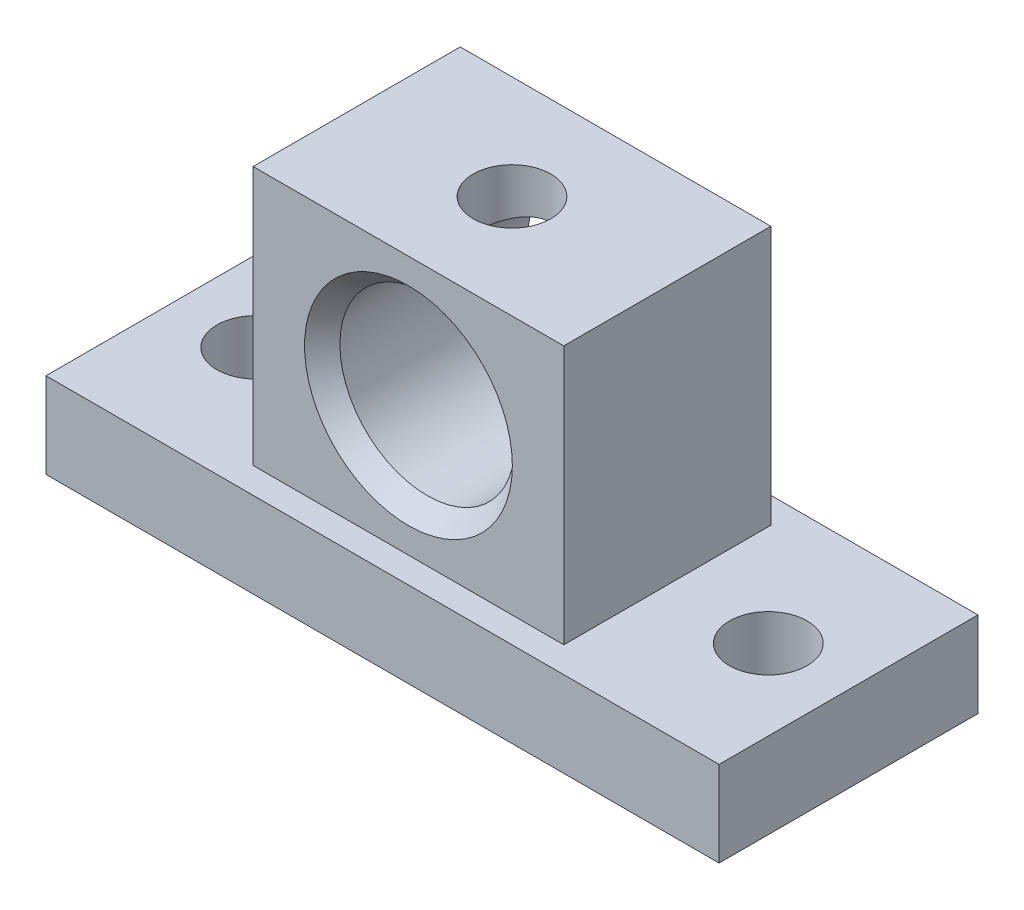
from build123d import *

# Parameters (mm, degrees)
SKETCH1_W                               = 26
SKETCH1_H                               = 10
SKETCH1_R                               = 1.5
BOSS_EXTRUDE5_DEPTH                     = 3.302
CROQUIS7_W                              = 12
CROQUIS7_H                              = 8
SALIENTE_EXTRUIR2_DEPTH                 = 10
TALADRO_DE_MARGEN_PARA_1_43_D           = 6.7564
TALADRO_DE_MARGEN_PARA_1_43_CSINK_D     = 8.0264
TALADRO_DE_MARGEN_PARA_1_43_CSINK_ANGLE = 82
CROQUIS13_R                             = 1.5
CORTAR_EXTRUIR3_DEPTH                   = 3


with BuildPart() as part:
    # Sketch1 → Boss-Extrude5 (new body)
    with BuildSketch(Plane(origin=(0, 0, 0), x_dir=(1, 0, 0), z_dir=(0, 1, 0))):
        Rectangle(SKETCH1_W, SKETCH1_H)
        with Locations(Location((-9.9, 0, 0), (0, 0, 90))):
            Circle(SKETCH1_R, mode=Mode.SUBTRACT)
        with Locations(Location((9.9, 0, 0), (0, 0, 90))):
            Circle(SKETCH1_R, mode=Mode.SUBTRACT)
    extrude(amount=BOSS_EXTRUDE5_DEPTH)

    # Croquis7 → Saliente-Extruir2 (add)
    with BuildSketch(Plane(origin=(0, 3.302, 0), x_dir=(1, 0, 0), z_dir=(0, 1, 0))):
        Rectangle(CROQUIS7_W, CROQUIS7_H)
    extrude(amount=SALIENTE_EXTRUIR2_DEPTH)

    # Taladro de margen para 1/43 (through all)
    with Locations(Plane.XY.offset(4)):
        with Locations((0, 8.302)):
            CounterSinkHole(TALADRO_DE_MARGEN_PARA_1_43_D / 2, TALADRO_DE_MARGEN_PARA_1_43_CSINK_D / 2, counter_sink_angle=TALADRO_DE_MARGEN_PARA_1_43_CSINK_ANGLE)

    # Croquis13 → Cortar-Extruir3 (cut)
    with BuildSketch(Plane(origin=(0, 13.302, 0), x_dir=(1, 0, 0), z_dir=(0, 1, 0))):
        with Locations(Location((0, 0, 0), (0, 0, 270))):
            Circle(CROQUIS13_R)
    extrude(amount=-CORTAR_EXTRUIR3_DEPTH, mode=Mode.SUBTRACT)


solid = part.part
